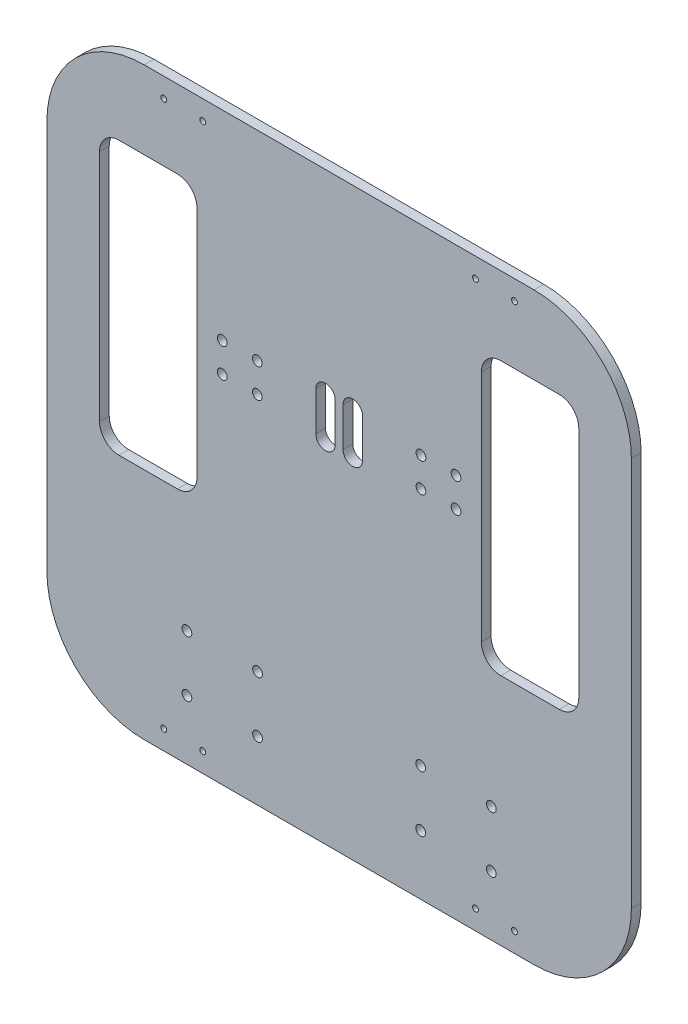
from build123d import *

# Parameters (mm, degrees)
SKETCH1_W           = 300
SKETCH1_H           = 300
SKETCH1_R           = 2.5
SKETCH1_W_2         = 50
SKETCH1_H_2         = 140
BOSS_EXTRUDE1_DEPTH = 5
CUT_EXTRUDE1_START  = -5
SKETCH2_R           = 2.5
CUT_EXTRUDE1_DEPTH  = 5
FILLET1_R           = 10
FILLET2_R           = 50
SKETCH3_W           = 10
SKETCH3_H           = 20
CUT_EXTRUDE2_DEPTH  = 213.190951739
CUT_EXTRUDE3_REACH  = 214.191
SKETCH4_R           = 1.5


with BuildPart() as part:
    # Sketch1 → Boss-Extrude1 (new body)
    with BuildSketch(Plane.XY):
        Rectangle(SKETCH1_W, SKETCH1_H)
        with Locations((42, 47.5)):
            Circle(SKETCH1_R, mode=Mode.SUBTRACT)
        with Locations((42, 32.5)):
            Circle(SKETCH1_R, mode=Mode.SUBTRACT)
        with Locations((60, 32.5)):
            Circle(SKETCH1_R, mode=Mode.SUBTRACT)
        with Locations((60, 47.5)):
            Circle(SKETCH1_R, mode=Mode.SUBTRACT)
        with Locations((-60, 47.5)):
            Circle(SKETCH1_R, mode=Mode.SUBTRACT)
        with Locations((-60, 32.5)):
            Circle(SKETCH1_R, mode=Mode.SUBTRACT)
        with Locations((-42, 32.5)):
            Circle(SKETCH1_R, mode=Mode.SUBTRACT)
        with Locations((-42, 47.5)):
            Circle(SKETCH1_R, mode=Mode.SUBTRACT)
        with Locations((98, 40)):
            Rectangle(SKETCH1_W_2, SKETCH1_H_2, mode=Mode.SUBTRACT)
        with Locations((-98, 40)):
            Rectangle(SKETCH1_W_2, SKETCH1_H_2, mode=Mode.SUBTRACT)
    extrude(amount=BOSS_EXTRUDE1_DEPTH)

    # Sketch2 → Cut-Extrude1 (cut)
    with BuildSketch(Plane.XY.offset(5).offset(CUT_EXTRUDE1_START)):
        with Locations((-60, 32.5)):
            Circle(SKETCH2_R)
        with Locations((-78.125, -90.6)):
            Circle(SKETCH2_R)
        with Locations((-41.875, -90.6)):
            Circle(SKETCH2_R)
        with Locations((-41.875, -119.4)):
            Circle(SKETCH2_R)
        with Locations((-78.125, -119.4)):
            Circle(SKETCH2_R)
        with Locations((78.125, -119.4)):
            Circle(SKETCH2_R)
        with Locations((41.875, -119.4)):
            Circle(SKETCH2_R)
        with Locations((41.875, -90.6)):
            Circle(SKETCH2_R)
        with Locations((78.125, -90.6)):
            Circle(SKETCH2_R)
    extrude(amount=CUT_EXTRUDE1_DEPTH, mode=Mode.SUBTRACT)

    # Fillet1
    fillet1_edges = [part.edges().sort_by_distance(p)[0] for p in [
        (-123, -30, 2.5),
        (-73, -30, 2.5),
        (-73, 110, 2.5),
        (-123, 110, 2.5),
        (73, -30, 2.5),
        (123, -30, 2.5),
        (123, 110, 2.5),
        (73, 110, 2.5),
    ]]
    fillet(fillet1_edges, radius=FILLET1_R)

    # Fillet2
    fillet2_edges = [part.edges().sort_by_distance(p)[0] for p in [
        (150, -150, 2.5),
        (-150, -150, 2.5),
        (-150, 150, 2.5),
        (150, 150, 2.5),
    ]]
    fillet(fillet2_edges, radius=FILLET2_R)

    # Sketch3 → Cut-Extrude2 (cut, through all)
    with BuildSketch(Plane.XY.offset(5)):
        with Locations((-7, 40)):
            Rectangle(SKETCH3_W, SKETCH3_H)
        with BuildLine():
            ThreePointArc((-12, 50), (-7, 55), (-2, 50))
            Line((-2, 50), (-12, 50))
        make_face()
        with BuildLine():
            Line((-12, 30), (-2, 30))
            ThreePointArc((-2, 30), (-7, 25), (-12, 30))
        make_face()
        with BuildLine():
            ThreePointArc((12, 30), (7, 25), (2, 30))
            Line((2, 30), (2, 50))
            ThreePointArc((2, 50), (7, 55), (12, 50))
            Line((12, 50), (12, 30))
        make_face()
    extrude(amount=-CUT_EXTRUDE2_DEPTH, mode=Mode.SUBTRACT)

    # Sketch4 → Cut-Extrude3 (cut, up to next)
    with BuildSketch(Plane.XY.offset(5), mode=Mode.PRIVATE) as cut_extrude3_sk1:
        with Locations((-70, -140)):
            Circle(SKETCH4_R)
    cut_extrude3_tool1 = extrude(cut_extrude3_sk1.sketch, amount=-CUT_EXTRUDE3_REACH, mode=Mode.PRIVATE) & part.part
    # Sketch4 → Cut-Extrude3 (cut, up to next)
    with BuildSketch(Plane.XY.offset(5), mode=Mode.PRIVATE) as cut_extrude3_sk2:
        with Locations((70, -140)):
            Circle(SKETCH4_R)
    cut_extrude3_tool2 = extrude(cut_extrude3_sk2.sketch, amount=-CUT_EXTRUDE3_REACH, mode=Mode.PRIVATE) & part.part
    # Sketch4 → Cut-Extrude3 (cut, up to next)
    with BuildSketch(Plane.XY.offset(5), mode=Mode.PRIVATE) as cut_extrude3_sk3:
        with Locations((-90, -140)):
            Circle(SKETCH4_R)
    cut_extrude3_tool3 = extrude(cut_extrude3_sk3.sketch, amount=-CUT_EXTRUDE3_REACH, mode=Mode.PRIVATE) & part.part
    # Sketch4 → Cut-Extrude3 (cut, up to next)
    with BuildSketch(Plane.XY.offset(5), mode=Mode.PRIVATE) as cut_extrude3_sk4:
        with Locations((90, -140)):
            Circle(SKETCH4_R)
    cut_extrude3_tool4 = extrude(cut_extrude3_sk4.sketch, amount=-CUT_EXTRUDE3_REACH, mode=Mode.PRIVATE) & part.part
    # Sketch4 → Cut-Extrude3 (cut, up to next)
    with BuildSketch(Plane.XY.offset(5), mode=Mode.PRIVATE) as cut_extrude3_sk5:
        with Locations((90, 140)):
            Circle(SKETCH4_R)
    cut_extrude3_tool5 = extrude(cut_extrude3_sk5.sketch, amount=-CUT_EXTRUDE3_REACH, mode=Mode.PRIVATE) & part.part
    # Sketch4 → Cut-Extrude3 (cut, up to next)
    with BuildSketch(Plane.XY.offset(5), mode=Mode.PRIVATE) as cut_extrude3_sk6:
        with Locations((-90, 140)):
            Circle(SKETCH4_R)
    cut_extrude3_tool6 = extrude(cut_extrude3_sk6.sketch, amount=-CUT_EXTRUDE3_REACH, mode=Mode.PRIVATE) & part.part
    # Sketch4 → Cut-Extrude3 (cut, up to next)
    with BuildSketch(Plane.XY.offset(5), mode=Mode.PRIVATE) as cut_extrude3_sk7:
        with Locations((70, 140)):
            Circle(SKETCH4_R)
    cut_extrude3_tool7 = extrude(cut_extrude3_sk7.sketch, amount=-CUT_EXTRUDE3_REACH, mode=Mode.PRIVATE) & part.part
    # Sketch4 → Cut-Extrude3 (cut, up to next)
    with BuildSketch(Plane.XY.offset(5), mode=Mode.PRIVATE) as cut_extrude3_sk8:
        with Locations((-70, 140)):
            Circle(SKETCH4_R)
    cut_extrude3_tool8 = extrude(cut_extrude3_sk8.sketch, amount=-CUT_EXTRUDE3_REACH, mode=Mode.PRIVATE) & part.part
    add(cut_extrude3_tool1.solids().sort_by_distance((-70, -140, 5))[0], mode=Mode.SUBTRACT)
    add(cut_extrude3_tool2.solids().sort_by_distance((70, -140, 5))[0], mode=Mode.SUBTRACT)
    add(cut_extrude3_tool3.solids().sort_by_distance((-90, -140, 5))[0], mode=Mode.SUBTRACT)
    add(cut_extrude3_tool4.solids().sort_by_distance((90, -140, 5))[0], mode=Mode.SUBTRACT)
    add(cut_extrude3_tool5.solids().sort_by_distance((90, 140, 5))[0], mode=Mode.SUBTRACT)
    add(cut_extrude3_tool6.solids().sort_by_distance((-90, 140, 5))[0], mode=Mode.SUBTRACT)
    add(cut_extrude3_tool7.solids().sort_by_distance((70, 140, 5))[0], mode=Mode.SUBTRACT)
    add(cut_extrude3_tool8.solids().sort_by_distance((-70, 140, 5))[0], mode=Mode.SUBTRACT)


solid = part.part
